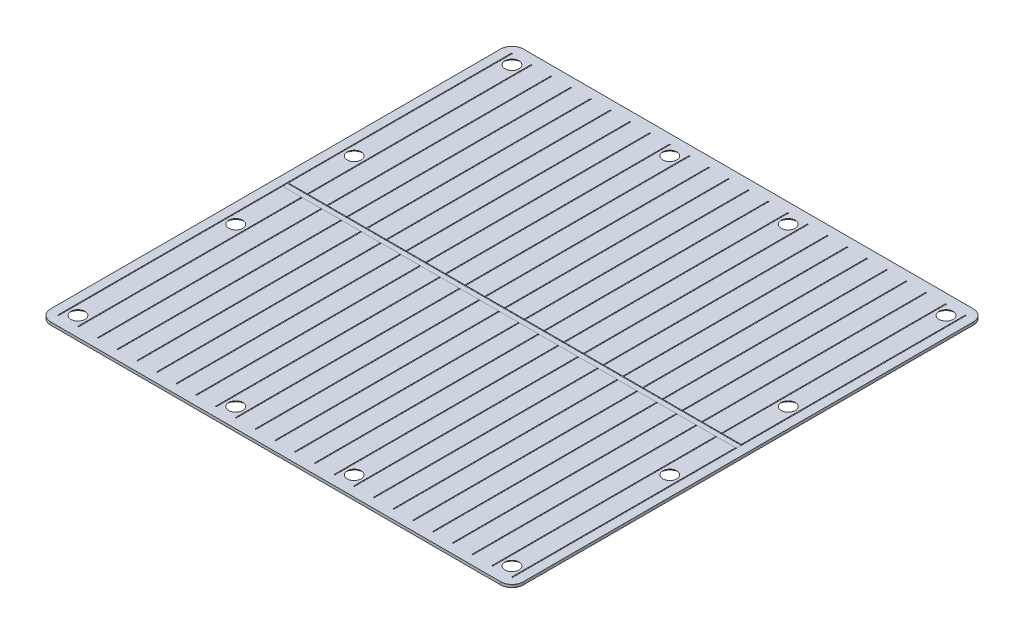
from build123d import *

# Parameters (mm, degrees)
SKETCH1_W                                      = 250
SKETCH1_H                                      = 250
BOSS_EXTRUDE1_DEPTH                            = 1.5
CUT_EXTRUDE1_START                             = -5
SKETCH3_R                                      = 0.25
CUT_EXTRUDE1_DEPTH                             = 240
LPATTERN1_COUNT                                = 24
LPATTERN1_PITCH                                = 10.434782609
CUT_EXTRUDE2_START                             = -5
CUT_EXTRUDE2_DEPTH                             = 240
CSK_FOR_M5_FLAT_HEAD_MACHINE_SCREW1_AT_2_COUNT = 2
CSK_FOR_M5_FLAT_HEAD_MACHINE_SCREW1_AT_2_PITCH = 83.47826087
CSK_FOR_M5_FLAT_HEAD_MACHINE_SCREW1_AT_3_COUNT = 2
CSK_FOR_M5_FLAT_HEAD_MACHINE_SCREW1_AT_3_PITCH = 146.086956522
CSK_FOR_M5_FLAT_HEAD_MACHINE_SCREW1_AT_4_COUNT = 2
CSK_FOR_M5_FLAT_HEAD_MACHINE_SCREW1_AT_4_PITCH = 229.565217391
CSK_FOR_M5_FLAT_HEAD_MACHINE_SCREW1_AT_5_COUNT = 2
CSK_FOR_M5_FLAT_HEAD_MACHINE_SCREW1_AT_5_PITCH = 244.271998137
CSK_FOR_M5_FLAT_HEAD_MACHINE_SCREW1_AT_6_COUNT = 2
CSK_FOR_M5_FLAT_HEAD_MACHINE_SCREW1_AT_6_PITCH = 272.105839522
CSK_FOR_M5_FLAT_HEAD_MACHINE_SCREW1_AT_7_COUNT = 2
CSK_FOR_M5_FLAT_HEAD_MACHINE_SCREW1_AT_7_PITCH = 146.086956522
CSK_FOR_M5_FLAT_HEAD_MACHINE_SCREW1_AT_8_COUNT = 2
CSK_FOR_M5_FLAT_HEAD_MACHINE_SCREW1_AT_8_PITCH = 83.47826087
CSK_FOR_M5_FLAT_HEAD_MACHINE_SCREW1_AT_9_COUNT = 2
CSK_FOR_M5_FLAT_HEAD_MACHINE_SCREW1_AT_9_PITCH = 229.565217391
CSK_FOR_M5_FLAT_HEAD_MACHINE_SCREW1_AT_1_COUNT = 2
CSK_FOR_M5_FLAT_HEAD_MACHINE_SCREW1_AT_1_PITCH = 244.271998137
CSK_FOR_M5_FLAT_HEAD_MACHINE_SCREW1_2_COUNT    = 2
CSK_FOR_M5_FLAT_HEAD_MACHINE_SCREW1_2_PITCH    = 272.105839522
CSK_FOR_M5_FLAT_HEAD_MACHINE_SCREW1_3_COUNT    = 2
CSK_FOR_M5_FLAT_HEAD_MACHINE_SCREW1_3_PITCH    = 324.654243884
FILLET1_R                                      = 6


with BuildPart() as part:
    # Sketch1 → Boss-Extrude1 (new body)
    with BuildSketch(Plane(origin=(0, 0, 0), x_dir=(1, 0, 0), z_dir=(0, 1, 0))):
        Rectangle(SKETCH1_W, SKETCH1_H)
    extrude(amount=BOSS_EXTRUDE1_DEPTH)

    # Sketch3 → Cut-Extrude1 (cut)
    with BuildSketch(Plane.XY.offset(125).offset(CUT_EXTRUDE1_START)):
        with Locations((-120, 1.5)):
            Circle(SKETCH3_R)
    cut_extrude1 = extrude(amount=-CUT_EXTRUDE1_DEPTH, mode=Mode.SUBTRACT)

    # LPattern1: Cut-Extrude1 ×24
    with Locations(*[(i * LPATTERN1_PITCH, 0, 0) for i in range(1, LPATTERN1_COUNT)]):
        add(cut_extrude1, mode=Mode.SUBTRACT)

    # Sketch4 → Cut-Extrude2 (cut)
    with BuildSketch(Plane.ZY.offset(125).offset(CUT_EXTRUDE2_START)):
        with BuildLine():
            Line((-1.5, 1.5), (1.5, 1.5))
            ThreePointArc((1.5, 1.5), (1.426776695, 1.323223305), (1.25, 1.25))
            Line((1.25, 1.25), (-1.25, 1.25))
            ThreePointArc((-1.25, 1.25), (-1.426776695, 1.323223305), (-1.5, 1.5))
        make_face()
    extrude(amount=-CUT_EXTRUDE2_DEPTH, mode=Mode.SUBTRACT)

    # Sketch7 → CSK for M5 Flat Head Machine Screw1 (revolve, cut)
    with BuildSketch(Plane(origin=(-114.782608696, 0, 114.782608696), x_dir=(0, 0, -1), z_dir=(1, 0, 0))):
        Polygon((0, 0), (0, 1.5), (2.75, 1.5), (2.75, 2.45), (5.2, 0), align=None)
    csk_for_m5_flat_head_machine_screw1 = revolve(axis=Axis((-114.782608696, -6.35, 114.782608696), (0, 1, 0)), mode=Mode.SUBTRACT)

    # CSK for M5 Flat Head Machine Screw1 at 2: CSK for M5 Flat Head Machine Screw1 ×2
    with Locations(*[(0, 0, -i * CSK_FOR_M5_FLAT_HEAD_MACHINE_SCREW1_AT_2_PITCH) for i in range(1, CSK_FOR_M5_FLAT_HEAD_MACHINE_SCREW1_AT_2_COUNT)]):
        add(csk_for_m5_flat_head_machine_screw1, mode=Mode.SUBTRACT)

    # CSK for M5 Flat Head Machine Screw1 at 3: CSK for M5 Flat Head Machine Screw1 ×2
    with Locations(*[(0, 0, -i * CSK_FOR_M5_FLAT_HEAD_MACHINE_SCREW1_AT_3_PITCH) for i in range(1, CSK_FOR_M5_FLAT_HEAD_MACHINE_SCREW1_AT_3_COUNT)]):
        add(csk_for_m5_flat_head_machine_screw1, mode=Mode.SUBTRACT)

    # CSK for M5 Flat Head Machine Screw1 at 4: CSK for M5 Flat Head Machine Screw1 ×2
    with Locations(*[(0, 0, -i * CSK_FOR_M5_FLAT_HEAD_MACHINE_SCREW1_AT_4_PITCH) for i in range(1, CSK_FOR_M5_FLAT_HEAD_MACHINE_SCREW1_AT_4_COUNT)]):
        add(csk_for_m5_flat_head_machine_screw1, mode=Mode.SUBTRACT)

    # CSK for M5 Flat Head Machine Screw1 at 5: CSK for M5 Flat Head Machine Screw1 ×2
    with Locations(*[Vector(0.3417430630867043, 0, -0.9397934234884371) * (i * CSK_FOR_M5_FLAT_HEAD_MACHINE_SCREW1_AT_5_PITCH) for i in range(1, CSK_FOR_M5_FLAT_HEAD_MACHINE_SCREW1_AT_5_COUNT)]):
        add(csk_for_m5_flat_head_machine_screw1, mode=Mode.SUBTRACT)

    # CSK for M5 Flat Head Machine Screw1 at 6: CSK for M5 Flat Head Machine Screw1 ×2
    with Locations(*[Vector(0.5368754921931593, 0, -0.8436614877321075) * (i * CSK_FOR_M5_FLAT_HEAD_MACHINE_SCREW1_AT_6_PITCH) for i in range(1, CSK_FOR_M5_FLAT_HEAD_MACHINE_SCREW1_AT_6_COUNT)]):
        add(csk_for_m5_flat_head_machine_screw1, mode=Mode.SUBTRACT)

    # CSK for M5 Flat Head Machine Screw1 at 7: CSK for M5 Flat Head Machine Screw1 ×2
    with Locations(*[(i * CSK_FOR_M5_FLAT_HEAD_MACHINE_SCREW1_AT_7_PITCH, 0, 0) for i in range(1, CSK_FOR_M5_FLAT_HEAD_MACHINE_SCREW1_AT_7_COUNT)]):
        add(csk_for_m5_flat_head_machine_screw1, mode=Mode.SUBTRACT)

    # CSK for M5 Flat Head Machine Screw1 at 8: CSK for M5 Flat Head Machine Screw1 ×2
    with Locations(*[(i * CSK_FOR_M5_FLAT_HEAD_MACHINE_SCREW1_AT_8_PITCH, 0, 0) for i in range(1, CSK_FOR_M5_FLAT_HEAD_MACHINE_SCREW1_AT_8_COUNT)]):
        add(csk_for_m5_flat_head_machine_screw1, mode=Mode.SUBTRACT)

    # CSK for M5 Flat Head Machine Screw1 at 9: CSK for M5 Flat Head Machine Screw1 ×2
    with Locations(*[(i * CSK_FOR_M5_FLAT_HEAD_MACHINE_SCREW1_AT_9_PITCH, 0, 0) for i in range(1, CSK_FOR_M5_FLAT_HEAD_MACHINE_SCREW1_AT_9_COUNT)]):
        add(csk_for_m5_flat_head_machine_screw1, mode=Mode.SUBTRACT)

    # CSK for M5 Flat Head Machine Screw1 at 1: CSK for M5 Flat Head Machine Screw1 ×2
    with Locations(*[Vector(0.9397934234884371, 0, -0.3417430630867046) * (i * CSK_FOR_M5_FLAT_HEAD_MACHINE_SCREW1_AT_1_PITCH) for i in range(1, CSK_FOR_M5_FLAT_HEAD_MACHINE_SCREW1_AT_1_COUNT)]):
        add(csk_for_m5_flat_head_machine_screw1, mode=Mode.SUBTRACT)

    # CSK for M5 Flat Head Machine Screw1  2: CSK for M5 Flat Head Machine Screw1 ×2
    with Locations(*[Vector(0.8436614877321073, 0, -0.5368754921931598) * (i * CSK_FOR_M5_FLAT_HEAD_MACHINE_SCREW1_2_PITCH) for i in range(1, CSK_FOR_M5_FLAT_HEAD_MACHINE_SCREW1_2_COUNT)]):
        add(csk_for_m5_flat_head_machine_screw1, mode=Mode.SUBTRACT)

    # CSK for M5 Flat Head Machine Screw1  3: CSK for M5 Flat Head Machine Screw1 ×2
    with Locations(*[Vector(0.7071067811865476, 0, -0.7071067811865476) * (i * CSK_FOR_M5_FLAT_HEAD_MACHINE_SCREW1_3_PITCH) for i in range(1, CSK_FOR_M5_FLAT_HEAD_MACHINE_SCREW1_3_COUNT)]):
        add(csk_for_m5_flat_head_machine_screw1, mode=Mode.SUBTRACT)

    # Fillet1
    fillet1_edges = [part.edges().sort_by_distance(p)[0] for p in [
        (125, 0.75, 125),
        (-125, 0.75, 125),
        (-125, 0.75, -125),
        (125, 0.75, -125),
    ]]
    fillet(fillet1_edges, radius=FILLET1_R)


solid = part.part
